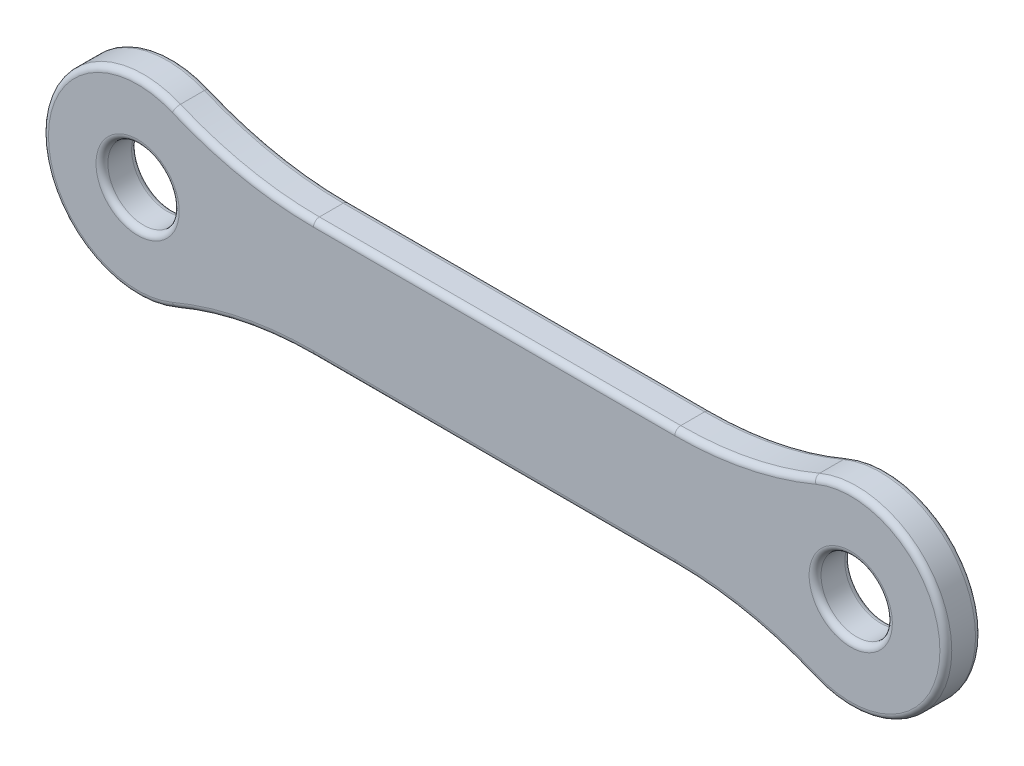
from build123d import *

# Parameters (mm, degrees)
SKETCH_1_R      = 3
EXTRUDE_1_DEPTH = 3
EXTRUDE_START   = -3
SKETCH_3_R      = 8
SKETCH_3_R_2    = 3
EXTRUDE_2_DEPTH = 3
FILLET_2_R      = 30
FILLET_1_R      = 0.5


with BuildPart() as part:
    # ｽｹｯﾁ1 → ﾎﾞｽ - 押し出し1 (new body)
    with BuildSketch(Plane.XY):
        with BuildLine():
            Line((0, 5), (60, 5))
            ThreePointArc((60, 5), (65, 0), (60, -5))
            Line((60, -5), (0, -5))
            ThreePointArc((0, -5), (-5, 0), (0, 5))
        make_face()
        Circle(SKETCH_1_R, mode=Mode.SUBTRACT)
        with Locations((60, 0)):
            Circle(SKETCH_1_R, mode=Mode.SUBTRACT)
    extrude(amount=EXTRUDE_1_DEPTH)

    # ｽｹｯﾁ3 → ﾎﾞｽ - 押し出し2 (add)
    # profile 1 of 2: a face of its own
    with BuildSketch(Plane.XY.offset(3).offset(EXTRUDE_START)):
        Circle(SKETCH_3_R)
        Circle(SKETCH_3_R_2, mode=Mode.SUBTRACT)
    # profile 2 of 2: a face of its own
    with BuildSketch(Plane.XY.offset(3).offset(EXTRUDE_START)):
        with Locations((60, 0)):
            Circle(SKETCH_3_R)
        with Locations((60, 0)):
            Circle(SKETCH_3_R_2, mode=Mode.SUBTRACT)
    extrude(amount=EXTRUDE_2_DEPTH)

    # ﾌｨﾚｯﾄ2
    fillet_2_edges = [part.edges().sort_by_distance(p)[0] for p in [
        (6.244997998, 5, 1.5),
        (6.244997998, -5, 1.5),
        (53.755002002, 5, 1.5),
        (53.755002002, -5, 1.5),
    ]]
    fillet(fillet_2_edges, radius=FILLET_2_R)

    # ﾌｨﾚｯﾄ1
    fillet_1_edges = [part.edges().sort_by_distance(p)[0] for p in [
        (-3, 0, 0),
        (-3, 0, 3),
        (57, 0, 0),
        (57, 0, 3),
        (30, -5, 0),
        (30, -5, 3),
        (-8, 0, 3),
        (-8, 0, 0),
        (68, 0, 0),
        (68, 0, 3),
        (30, 5, 3),
        (30, 5, 0),
        (8.83825298, -5.598066659, 0),
        (8.83825298, -5.598066659, 3),
        (51.16174702, -5.598066659, 3),
        (51.16174702, -5.598066659, 0),
        (51.16174702, 5.598066659, 0),
        (51.16174702, 5.598066659, 3),
        (8.83825298, 5.598066659, 3),
        (8.83825298, 5.598066659, 0),
    ]]
    fillet(fillet_1_edges, radius=FILLET_1_R)


solid = part.part
